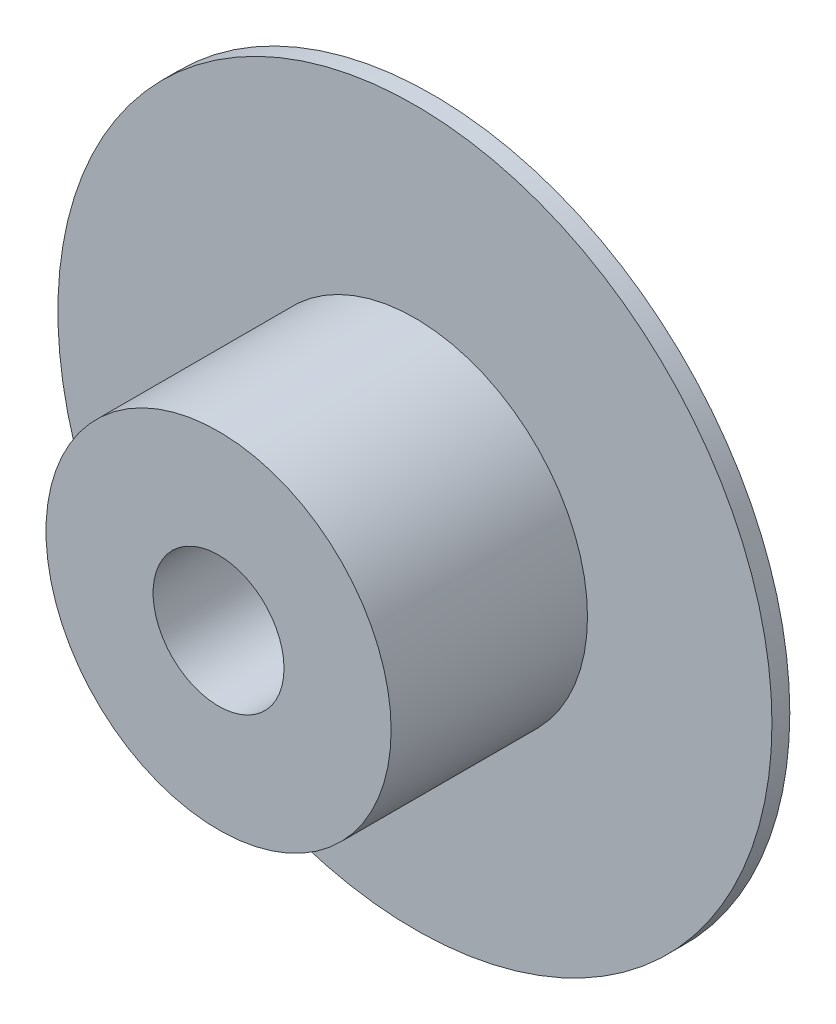
from build123d import *

# Parameters (mm, degrees)
SKETCH1_R           = 30
BOSS_EXTRUDE1_DEPTH = 1.5
SKETCH2_R           = 14.5
SKETCH2_R_2         = 5.5
EXTRUDE_THIN1_DEPTH = 18


with BuildPart() as part:
    # Sketch1 → Boss-Extrude1 (new body)
    with BuildSketch(Plane.XY):
        Circle(SKETCH1_R)
    extrude(amount=BOSS_EXTRUDE1_DEPTH)

    # Sketch2 → Extrude-Thin1 (add)
    with BuildSketch(Plane.XY):
        Circle(SKETCH2_R)
        Circle(SKETCH2_R_2, mode=Mode.SUBTRACT)
    extrude(amount=EXTRUDE_THIN1_DEPTH)


solid = part.part
